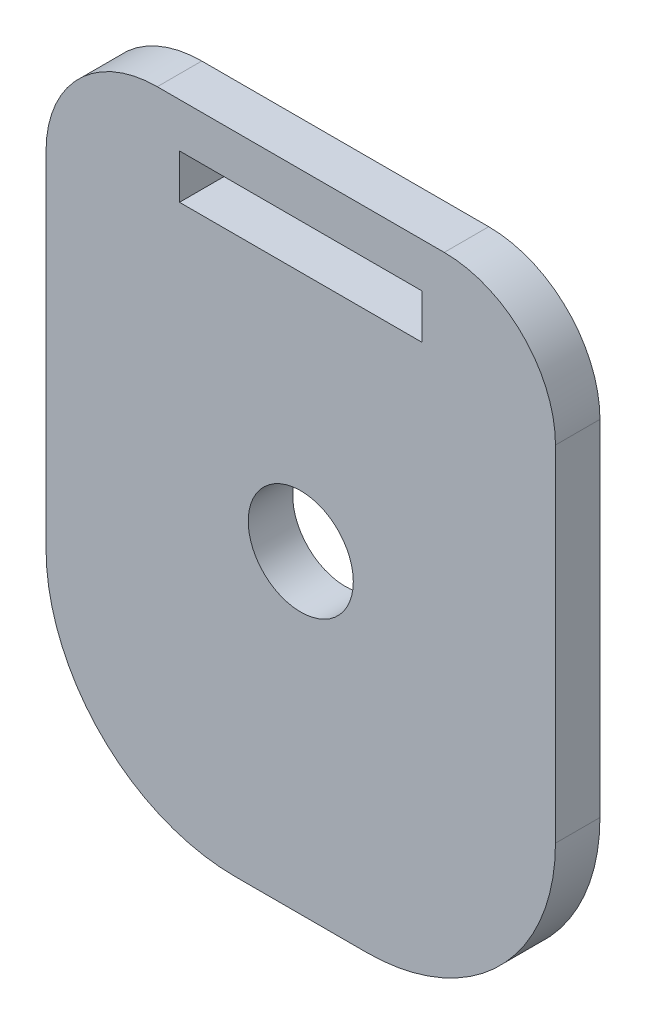
from build123d import *

# Parameters (mm, degrees)
SKETCH1_W           = 58.166
SKETCH1_H           = 73.66
BOSS_EXTRUDE1_DEPTH = 5.08
SKETCH2_W           = 27.686
SKETCH2_H           = 5.08
CUT_EXTRUDE1_DEPTH  = 94.994071919
SKETCH7_R           = 6
CUT_EXTRUDE2_DEPTH  = 94.994071919
FILLET1_R           = 21.59
FILLET2_R           = 12.7


with BuildPart() as part:
    # Sketch1 → Boss-Extrude1 (new body)
    with BuildSketch(Plane.XY):
        with Locations((29.083, 36.83)):
            Rectangle(SKETCH1_W, SKETCH1_H)
    extrude(amount=BOSS_EXTRUDE1_DEPTH)

    # Sketch2 → Cut-Extrude1 (cut, through all)
    with BuildSketch(Plane.XY.offset(5.08)):
        with Locations((29.083, 66.04)):
            Rectangle(SKETCH2_W, SKETCH2_H)
    extrude(amount=-CUT_EXTRUDE1_DEPTH, mode=Mode.SUBTRACT)

    # Sketch7 → Cut-Extrude2 (cut, through all)
    with BuildSketch(Plane.XY.offset(5.08)):
        with Locations((29.083, 35.9)):
            Circle(SKETCH7_R)
    extrude(amount=-CUT_EXTRUDE2_DEPTH, mode=Mode.SUBTRACT)

    # Fillet1
    fillet1_edges = [part.edges().sort_by_distance(p)[0] for p in [
        (58.166, 0, 2.54),
        (0, 0, 2.54),
    ]]
    fillet(fillet1_edges, radius=FILLET1_R)

    # Fillet2
    fillet2_edges = [part.edges().sort_by_distance(p)[0] for p in [
        (0, 73.66, 2.54),
        (58.166, 73.66, 2.54),
    ]]
    fillet(fillet2_edges, radius=FILLET2_R)


solid = part.part
